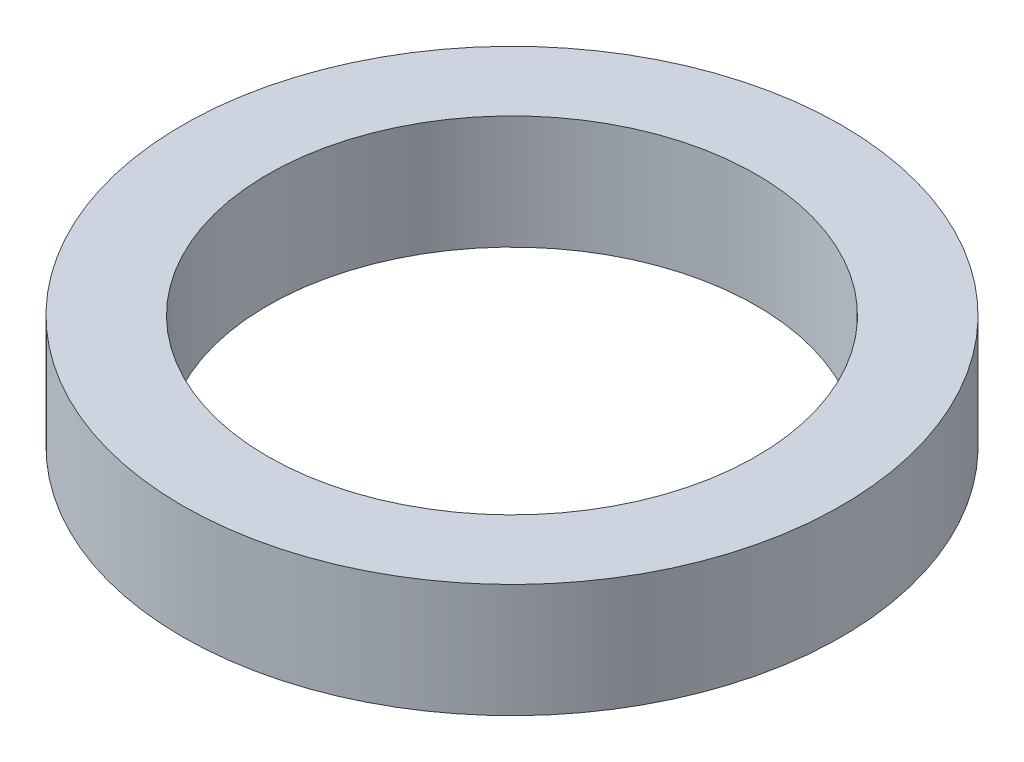
from build123d import *

# Parameters (mm, degrees)
SKETCH1_R           = 29
SKETCH1_R_2         = 21.5
BOSS_EXTRUDE1_DEPTH = 10


with BuildPart() as part:
    # Sketch1 → Boss-Extrude1 (new body)
    with BuildSketch(Plane(origin=(0, 0, 0), x_dir=(1, 0, 0), z_dir=(0, 1, 0))):
        with Locations(Location((0, 0, 0), (0, 0, 270))):
            Circle(SKETCH1_R)
        with Locations(Location((0, 0, 0), (0, 0, 270))):
            Circle(SKETCH1_R_2, mode=Mode.SUBTRACT)
    extrude(amount=BOSS_EXTRUDE1_DEPTH)


solid = part.part
